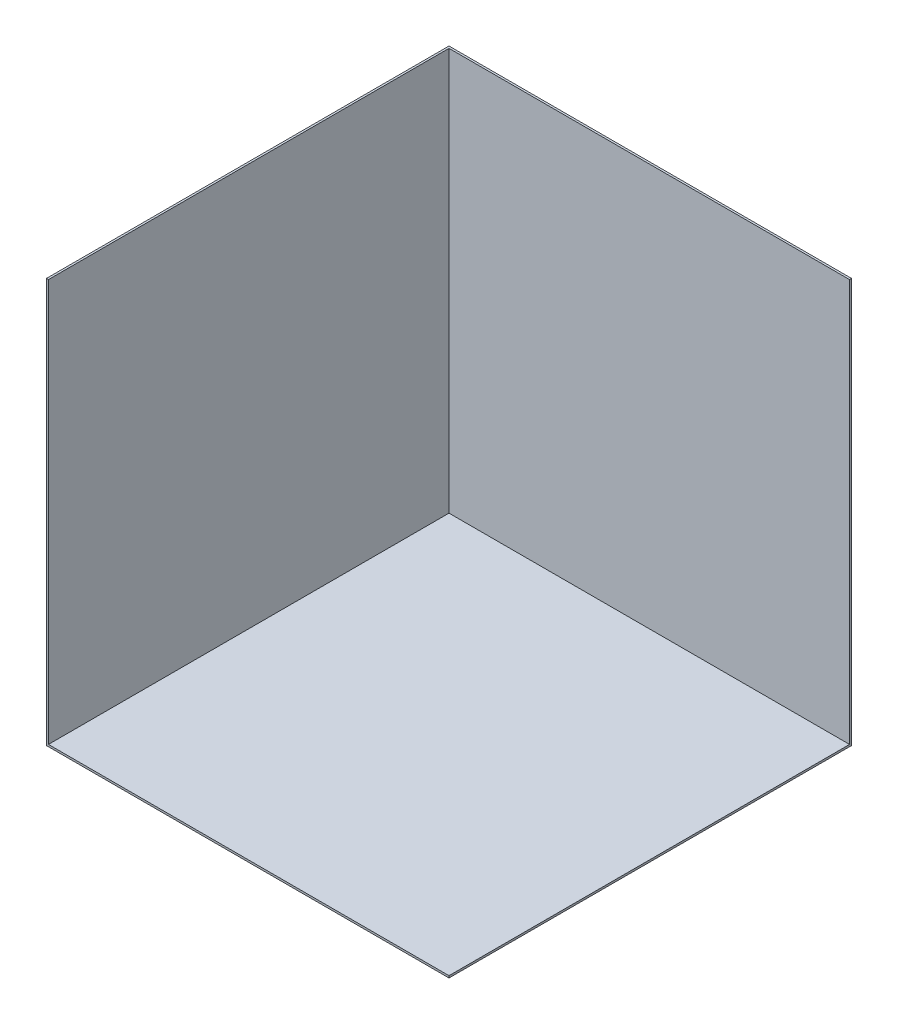
from build123d import *

# Parameters (mm, degrees)
SKETCH1_W           = 2000
SKETCH1_H           = 2000
BOSS_EXTRUDE1_DEPTH = 10
SKETCH2_W           = 1990
SKETCH2_H           = 10
SKETCH2_W_2         = 10
SKETCH2_H_2         = 1990
BOSS_EXTRUDE2_DEPTH = 2000


with BuildPart() as part:
    # Sketch1 → Boss-Extrude1 (new body)
    with BuildSketch(Plane(origin=(0, 0, 0), x_dir=(1, 0, 0), z_dir=(0, 1, 0))):
        with Locations((-1000, 1000)):
            Rectangle(SKETCH1_W, SKETCH1_H)
    extrude(amount=BOSS_EXTRUDE1_DEPTH)

    # Sketch2 → Boss-Extrude2 (add)
    with BuildSketch(Plane(origin=(0, 10, 0), x_dir=(1, 0, 0), z_dir=(0, 1, 0))):
        with Locations((-995, 1995)):
            Rectangle(SKETCH2_W, SKETCH2_H)
        with Locations((-1995, 1995)):
            Rectangle(SKETCH2_W_2, SKETCH2_H)
        with Locations((-1995, 995)):
            Rectangle(SKETCH2_W_2, SKETCH2_H_2)
    extrude(amount=BOSS_EXTRUDE2_DEPTH)


solid = part.part
